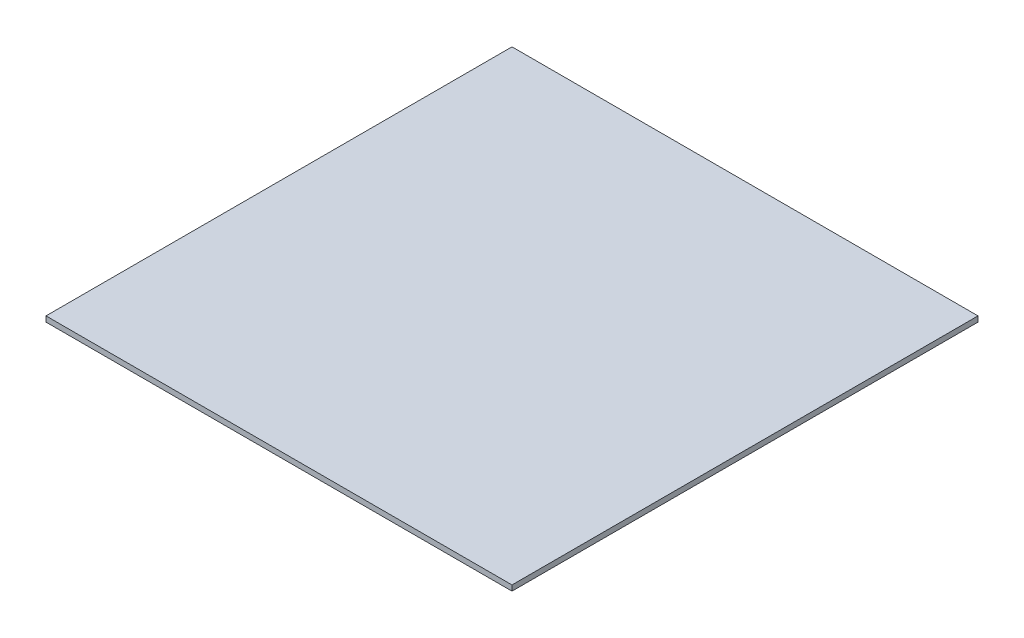
from build123d import *

# Parameters (mm, degrees)
SKETCH_1_W      = 430
SKETCH_1_H      = 430
EXTRUDE_1_DEPTH = 5


with BuildPart() as part:
    # 草图1 → 凸台-拉伸1 (new body)
    with BuildSketch(Plane(origin=(0, 0, 0), x_dir=(1, 0, 0), z_dir=(0, 1, 0))):
        Rectangle(SKETCH_1_W, SKETCH_1_H)
    extrude(amount=EXTRUDE_1_DEPTH)


solid = part.part
